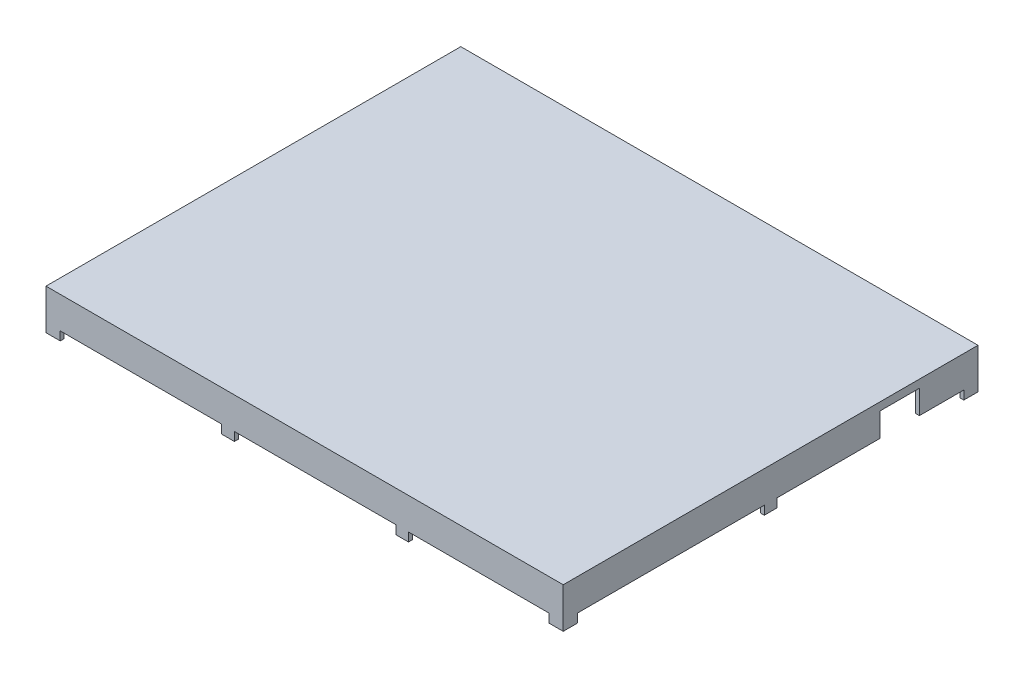
from build123d import *

# Parameters (mm, degrees)
SKETCH_1_W          = 65.34
SKETCH_1_H          = 52.4
EXTRUDE_2_DEPTH     = 5.1
SKETCH_1_5_W        = 64.34
SKETCH_1_5_H        = 51.4
CUT_EXTRUDE_2_DEPTH = 4.6
SKETCH_2_W          = 20.4
SKETCH_2_H          = 1.1
SKETCH_2_W_2        = 20.39
SKETCH_2_W_3        = 17.75
CUT_EXTRUDE_3_DEPTH = 56.4
SKETCH_9_W          = 23.6
SKETCH_9_H          = 1.1
CUT_EXTRUDE_4_DEPTH = 4.9
CUT_EXTRUDE_6_DEPTH = 4.9


with BuildPart() as part:
    # 草图1 → 凸台-拉伸2 (new body)
    with BuildSketch(Plane(origin=(0, 0, 0), x_dir=(1, 0, 0), z_dir=(0, 1, 0))):
        with Locations((32.67, 26.2)):
            Rectangle(SKETCH_1_W, SKETCH_1_H)
    extrude(amount=EXTRUDE_2_DEPTH)

    # 草图1<5> → 切除-拉伸2 (cut)
    with BuildSketch(Plane(origin=(0, 0, 0), x_dir=(1, 0, 0), z_dir=(0, 1, 0))):
        with Locations((32.67, 26.2)):
            Rectangle(SKETCH_1_5_W, SKETCH_1_5_H)
    extrude(amount=CUT_EXTRUDE_2_DEPTH, mode=Mode.SUBTRACT)

    # 草图2 → 切除-拉伸3 (cut)
    with BuildSketch(Plane.XY):
        with Locations((12, 0.55)):
            Rectangle(SKETCH_2_W, SKETCH_2_H)
        with Locations((33.995, 0.55)):
            Rectangle(SKETCH_2_W_2, SKETCH_2_H)
        with Locations((54.665, 0.55)):
            Rectangle(SKETCH_2_W_3, SKETCH_2_H)
    extrude(amount=-CUT_EXTRUDE_3_DEPTH, mode=Mode.SUBTRACT)

    # 草图9 → 切除-拉伸4 (cut)
    with BuildSketch(Plane(origin=(65.34, 0, 0), x_dir=(0, 0, -1), z_dir=(1, 0, 0))):
        with Locations((13.6, 0.55)):
            Rectangle(SKETCH_9_W, SKETCH_9_H)
        Polygon((27, 0), (50.6, 0), (50.6, 1.1), (45, 1.1), (45, 4.1), (40, 4.1), (40, 1.1), (27, 1.1), align=None)
    extrude(amount=-CUT_EXTRUDE_4_DEPTH, mode=Mode.SUBTRACT)

    # 草图13 → 切除-拉伸6 (cut)
    with BuildSketch(Plane.ZY):
        Polygon((-50.6, 0), (-50.6, 1.1), (-41.77, 1.1), (-41.77, 4.1), (-18.8, 4.1), (-18.8, 1.1), (-1.8, 1.1), (-1.8, 0), align=None)
    extrude(amount=-CUT_EXTRUDE_6_DEPTH, mode=Mode.SUBTRACT)


solid = part.part
